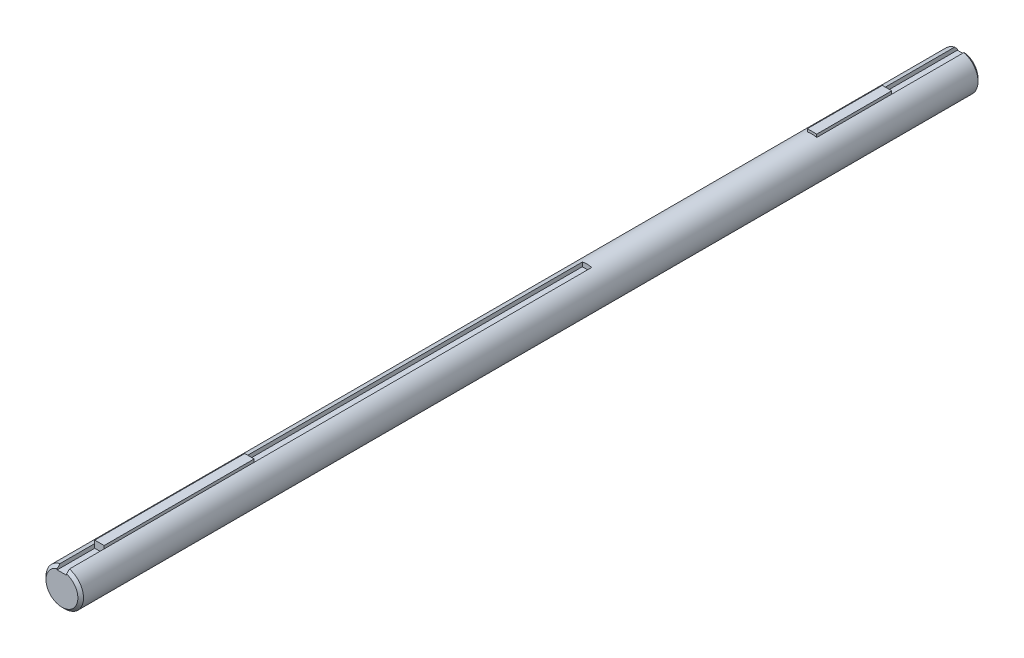
from build123d import *

# Parameters (mm, degrees)
SKETCH1_R           = 12.7
EXTRUDE1_DEPTH      = 304.8
CHAMFER1_SIZE       = 1.905
EXTRUDE2_DEPTH      = 306.328708116
EXTRUDE2_DEPTH_BACK = 306.328708116
SKETCH3_W           = 6.35
SKETCH3_H           = 3.175
EXTRUDE3_START      = -203.2
SKETCH1_2_R         = 12.7
EXTRUDE3_DEPTH      = 152.4
SKETCH5_W           = 6.35
SKETCH5_H           = 4.7625
EXTRUDE4_DEPTH      = 50.8
SKETCH6_W           = 6.35
SKETCH6_H           = 4.7625
EXTRUDE5_DEPTH      = 25.4


with BuildPart() as part:
    # Sketch1 → Extrude1 (new, symmetric)
    with BuildSketch(Plane.XY):
        with Locations(Location((0, 0, 0), (0, 0, 180))):
            Circle(SKETCH1_R)
    extrude(amount=EXTRUDE1_DEPTH, both=True)

    # Chamfer1
    chamfer1_edges = [part.edges().sort_by_distance(p)[0] for p in [
        (12.7, 0, -304.8),
        (12.7, 0, 304.8),
    ]]
    chamfer(chamfer1_edges, length=CHAMFER1_SIZE)

    # Sketch3 → Extrude2 (cut, two sides: drawn at the far end of the back side and taken through both)
    with BuildSketch(Plane.XY.offset(-EXTRUDE2_DEPTH_BACK)):
        with Locations((0, 11.1125)):
            Rectangle(SKETCH3_W, SKETCH3_H)
    extrude(amount=EXTRUDE2_DEPTH + EXTRUDE2_DEPTH_BACK, mode=Mode.SUBTRACT)

    # Sketch1<2> → Extrude3 (add)
    with BuildSketch(Plane.XY.offset(EXTRUDE3_START)):
        with Locations(Location((0, 0, 0), (0, 0, 104.477512186))):
            Circle(SKETCH1_2_R)
    extrude(amount=EXTRUDE3_DEPTH)


with BuildPart() as body_2:
    # Sketch5 → Extrude4 (new, symmetric)
    with BuildSketch(Plane.XY.offset(228.6)):
        with Locations((0, 11.90625)):
            Rectangle(SKETCH5_W, SKETCH5_H)
    extrude(amount=EXTRUDE4_DEPTH, both=True)


with BuildPart() as body_3:
    # Sketch6 → Extrude5 (new, symmetric)
    with BuildSketch(Plane(origin=(0, 0, -228.6), x_dir=(-1, 0, 0), z_dir=(0, 0, -1))):
        with Locations((0, 11.90625)):
            Rectangle(SKETCH6_W, SKETCH6_H)
    extrude(amount=EXTRUDE5_DEPTH, both=True)


solid = Compound([part.part, body_2.part, body_3.part])
